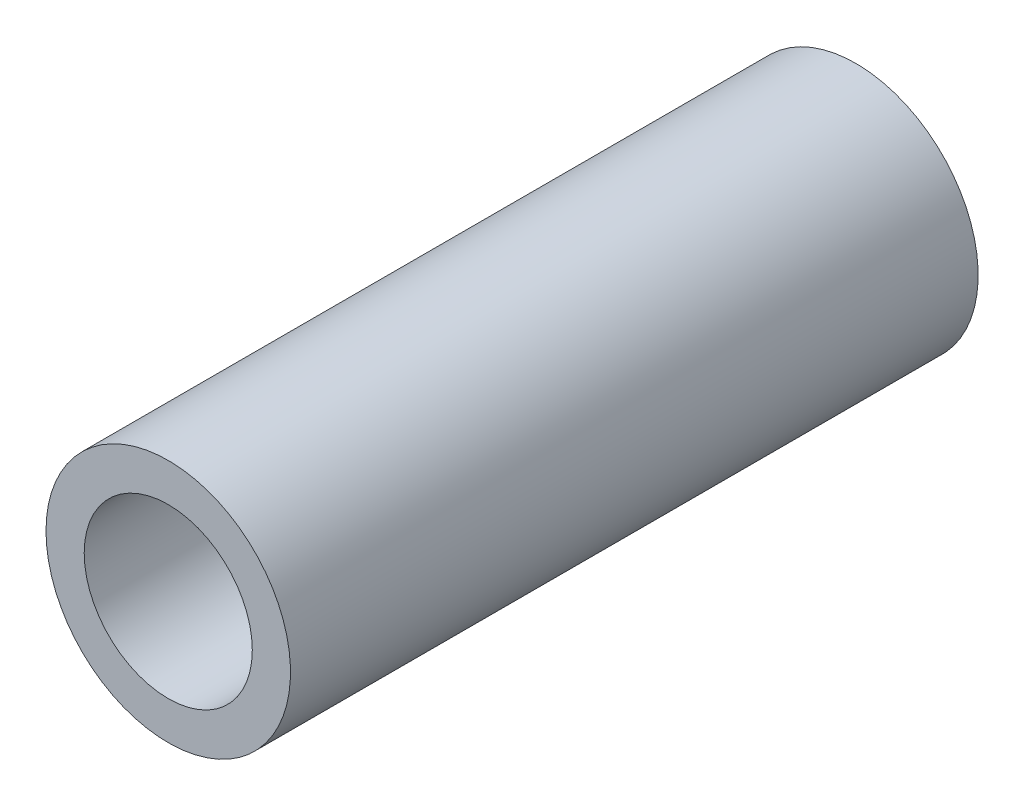
from build123d import *

# Parameters (mm, degrees)
ESQUISSE1_R        = 2
ESQUISSE1_R_2      = 1.375
BOSS_EXTRU_1_DEPTH = 11.25


with BuildPart() as part:
    # Esquisse1 → Boss.-Extru.1 (new body)
    with BuildSketch(Plane.XY):
        with Locations(Location((0, 0, 0), (0, 0, 180))):
            Circle(ESQUISSE1_R)
        with Locations(Location((0, 0, 0), (0, 0, 180))):
            Circle(ESQUISSE1_R_2, mode=Mode.SUBTRACT)
    extrude(amount=BOSS_EXTRU_1_DEPTH)


solid = part.part
